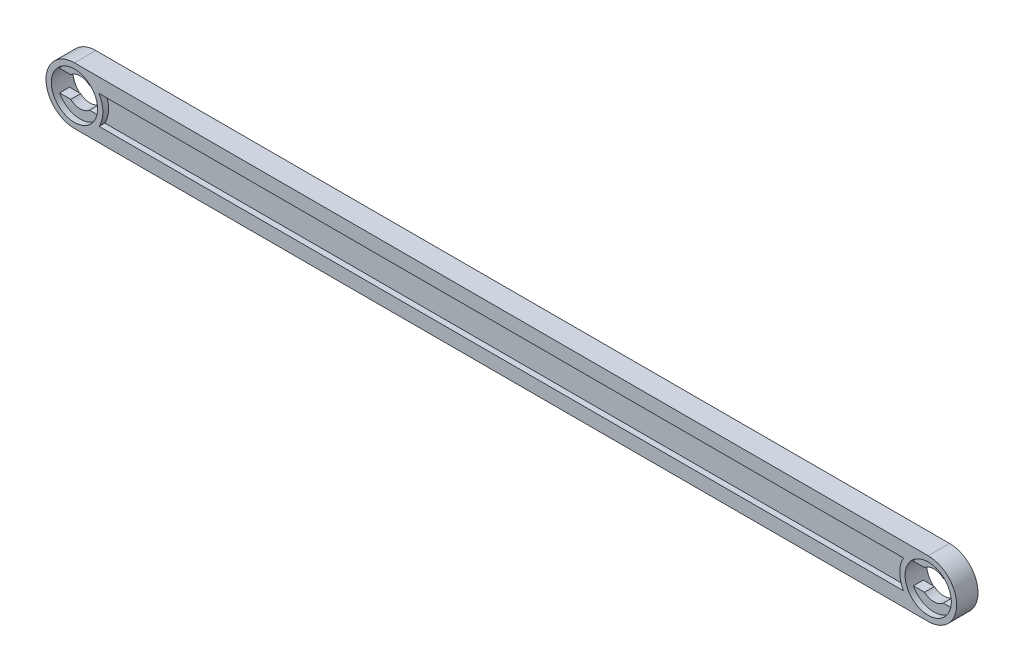
from build123d import *

# Parameters (mm, degrees)
EXTRUDE_1_DEPTH     = 3
CUT_EXTRUDE_1_REACH = 126.101
SKETCH_3_R          = 3.25
CUT_EXTRUDE_2_DEPTH = 0.8
CUT_EXTRUDE_START   = -2.2
SKETCH_3_2_R        = 3.25
CUT_EXTRUDE_3_DEPTH = 0.8
CUT_EXTRUDE_4_DEPTH = 0.8
SKETCH_5_W          = 112
SKETCH_5_H          = 4
CUT_EXTRUDE_5_DEPTH = 0.8


with BuildPart() as part:
    # 草图1 → 凸台-拉伸1 (new body)
    with BuildSketch(Plane.XY):
        with BuildLine():
            Line((0, 4), (120, 4))
            ThreePointArc((120, 4), (124, 0), (120, -4))
            Line((120, -4), (0, -4))
            ThreePointArc((0, -4), (-4, 0), (0, 4))
        make_face()
    extrude(amount=-EXTRUDE_1_DEPTH)

    # 草图2 → 切除-拉伸1 (cut, up to next)
    with BuildSketch(Plane.XY, mode=Mode.PRIVATE) as cut_extrude_1_sk1:
        with BuildLine():
            Line((1.322875656, -1.5), (2.883140649, -1.5))
            ThreePointArc((2.883140649, -1.5), (3.25, 0), (2.883140649, 1.5))
            Line((2.883140649, 1.5), (1.322875656, 1.5))
            ThreePointArc((1.322875656, 1.5), (0, 2), (-1.322875656, 1.5))
            Line((-1.322875656, 1.5), (-2.883140649, 1.5))
            ThreePointArc((-2.883140649, 1.5), (-3.25, 0), (-2.883140649, -1.5))
            Line((-2.883140649, -1.5), (-1.322875656, -1.5))
            ThreePointArc((-1.322875656, -1.5), (0, -2), (1.322875656, -1.5))
        make_face()
    cut_extrude_1_tool1 = extrude(cut_extrude_1_sk1.sketch, amount=-CUT_EXTRUDE_1_REACH, mode=Mode.PRIVATE) & part.part
    cut_extrude_1 = cut_extrude_1_tool1.solids().sort_by_distance((0, 0, 0))[0]
    add(cut_extrude_1, mode=Mode.SUBTRACT)

    # 草图3 → 切除-拉伸2 (cut)
    with BuildSketch(Plane.XY):
        Circle(SKETCH_3_R)
    cut_extrude_2 = extrude(amount=-CUT_EXTRUDE_2_DEPTH, mode=Mode.SUBTRACT)

    # 草图3<2> → 切除-拉伸3 (cut)
    with BuildSketch(Plane.XY.offset(CUT_EXTRUDE_START)):
        Circle(SKETCH_3_2_R)
    cut_extrude_3 = extrude(amount=-CUT_EXTRUDE_3_DEPTH, mode=Mode.SUBTRACT)

    # 镜向1: 切除-拉伸1, 切除-拉伸2, 切除-拉伸3 across plane
    add(cut_extrude_1.mirror(Plane(origin=(60, 0, 0), x_dir=(0, 0, 1), z_dir=(1, 0, 0))), mode=Mode.SUBTRACT)
    add(cut_extrude_2.mirror(Plane(origin=(60, 0, 0), x_dir=(0, 0, 1), z_dir=(1, 0, 0))), mode=Mode.SUBTRACT)
    add(cut_extrude_3.mirror(Plane(origin=(60, 0, 0), x_dir=(0, 0, 1), z_dir=(1, 0, 0))), mode=Mode.SUBTRACT)

    # 草图4 → 切除-拉伸4 (cut)
    with BuildSketch(Plane.XY):
        with BuildLine():
            Line((3.464101615, 2), (116.535898385, 2))
            ThreePointArc((116.535898385, 2), (116, 0), (116.535898385, -2))
            Line((116.535898385, -2), (3.464101615, -2))
            ThreePointArc((3.464101615, -2), (4, 0), (3.464101615, 2))
        make_face()
    extrude(amount=-CUT_EXTRUDE_4_DEPTH, mode=Mode.SUBTRACT)

    # 草图5 → 切除-拉伸5 (cut)
    with BuildSketch(Plane(origin=(0, 0, -3), x_dir=(-1, 0, 0), z_dir=(0, 0, -1))):
        with Locations((-60, 0)):
            Rectangle(SKETCH_5_W, SKETCH_5_H)
    extrude(amount=-CUT_EXTRUDE_5_DEPTH, mode=Mode.SUBTRACT)


solid = part.part
